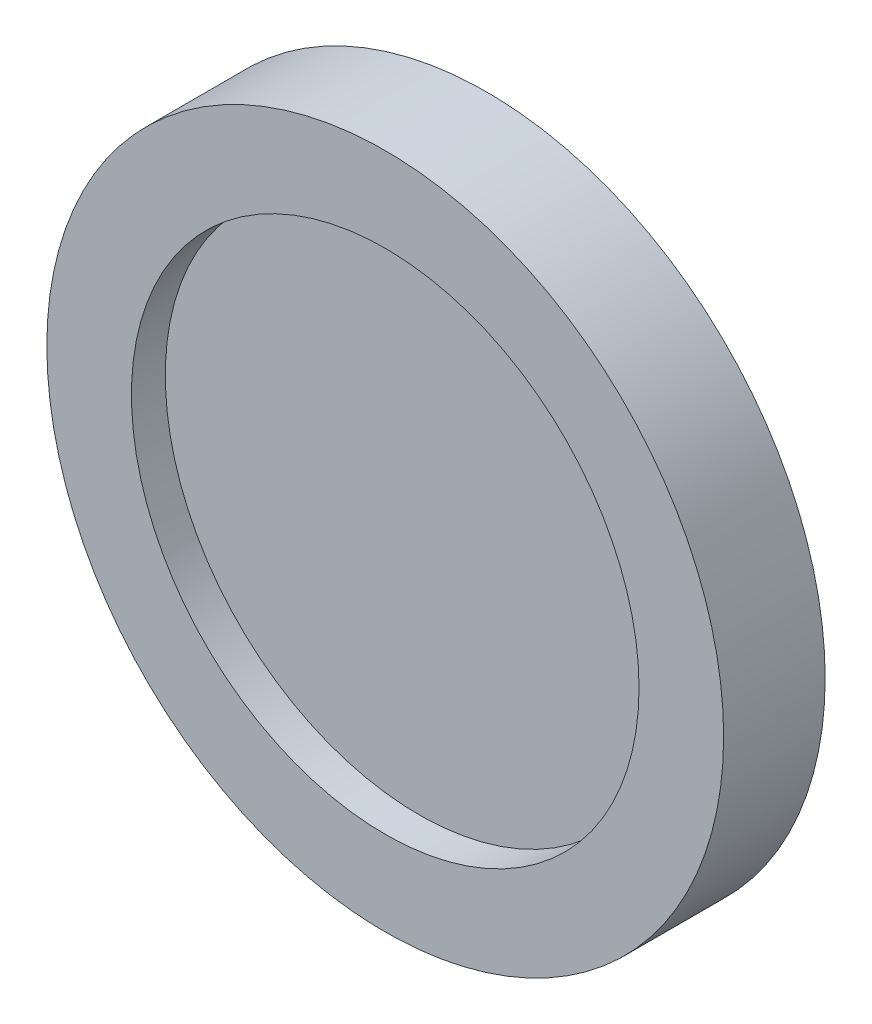
from build123d import *

# Parameters (mm, degrees)
SKETCH1_R           = 100
BOSS_EXTRUDE1_DEPTH = 30
SKETCH2_R           = 75
CUT_EXTRUDE1_DEPTH  = 10


with BuildPart() as part:
    # Sketch1 → Boss-Extrude1 (new body)
    with BuildSketch(Plane.XY):
        Circle(SKETCH1_R)
    extrude(amount=BOSS_EXTRUDE1_DEPTH)

    # Sketch2 → Cut-Extrude1 (cut)
    with BuildSketch(Plane.XY.offset(30)):
        Circle(SKETCH2_R)
    extrude(amount=-CUT_EXTRUDE1_DEPTH, mode=Mode.SUBTRACT)


solid = part.part
